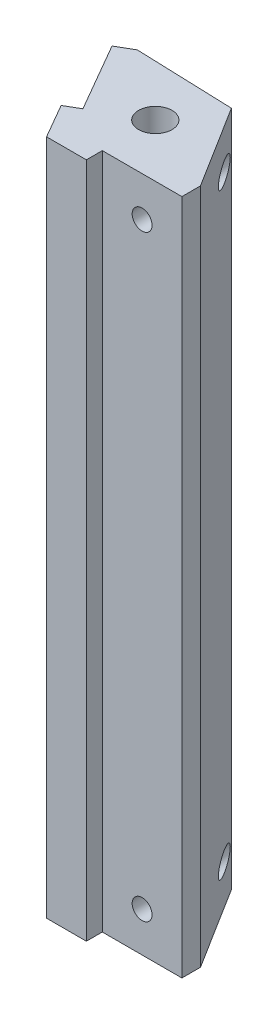
from build123d import *

# Parameters (mm, degrees)
BOSS_EXTRUDE1_DEPTH       = 85
SKETCH3_W                 = 10
SKETCH3_H                 = 2
CUT_EXTRUDE1_DEPTH        = 88.633826232
M5X0_8_TAPPED_HOLE1_D     = 4.2
M5X0_8_TAPPED_HOLE1_DEPTH = 16
M5X0_8_TAPPED_HOLE1_TIP   = 1.2618073
M5X0_8_TAPPED_HOLE2_D     = 4.2
M5X0_8_TAPPED_HOLE2_DEPTH = 16.4
M5X0_8_TAPPED_HOLE2_TIP   = 1.2618073
M3X0_5_TAPPED_HOLE1_D     = 2.5
M3X0_5_TAPPED_HOLE2_D     = 2.5


with BuildPart() as part:
    # Sketch1 → Boss-Extrude1 (new body)
    with BuildSketch(Plane(origin=(0, 0, 0), x_dir=(1, 0, 0), z_dir=(0, 1, 0))):
        Polygon((0, 0), (15, 0), (15, 4.330127019), (8.5, 14.722431864), (-3.75, 15.155444566), (-7.5, 12.990381057), align=None)
    extrude(amount=BOSS_EXTRUDE1_DEPTH)

    # Sketch3 → Cut-Extrude1 (cut, through all)
    with BuildSketch(Plane(origin=(0, 85, 0), x_dir=(1, 0, 0), z_dir=(0, 1, 0))):
        Polygon((-7.5, 12.990381057), (-5.767949192, 13.990381057), (-0.767949192, 5.330127019), (-2.5, 4.330127019), align=None)
        with Locations((10, 1)):
            Rectangle(SKETCH3_W, SKETCH3_H)
    extrude(amount=-CUT_EXTRUDE1_DEPTH, mode=Mode.SUBTRACT)

    # M5x0.8 Tapped Hole1
    with Locations(Plane(origin=(0, 85, 0), x_dir=(1, 0, 0), z_dir=(0, 1, 0))):
        with Locations((5, 8.660254038)):
            Hole(M5X0_8_TAPPED_HOLE1_D / 2, depth=M5X0_8_TAPPED_HOLE1_DEPTH)
            with Locations((0, 0, -(M5X0_8_TAPPED_HOLE1_DEPTH + M5X0_8_TAPPED_HOLE1_TIP / 2))):  # 118° drill point
                Cone(0, M5X0_8_TAPPED_HOLE1_D / 2, M5X0_8_TAPPED_HOLE1_TIP, mode=Mode.SUBTRACT)

    # M5x0.8 Tapped Hole2
    with Locations(Plane(origin=(0, 0, 0), x_dir=(-1, 0, 0), z_dir=(0, -1, 0))):
        with Locations((-5, 8.660254038)):
            Hole(M5X0_8_TAPPED_HOLE2_D / 2, depth=M5X0_8_TAPPED_HOLE2_DEPTH)
            with Locations((0, 0, -(M5X0_8_TAPPED_HOLE2_DEPTH + M5X0_8_TAPPED_HOLE2_TIP / 2))):  # 118° drill point
                Cone(0, M5X0_8_TAPPED_HOLE2_D / 2, M5X0_8_TAPPED_HOLE2_TIP, mode=Mode.SUBTRACT)

    # M3x0.5 Tapped Hole1 (through all)
    with Locations(Plane(origin=(1.732050808, 0, -1), x_dir=(0.49999999999999983, 0, 0.8660254037844387), z_dir=(-0.8660254037844387, 0, 0.49999999999999983))):
        with Locations((-10, 80), (-10, 5)):
            Hole(M3X0_5_TAPPED_HOLE1_D / 2)

    # M3x0.5 Tapped Hole2 (through all)
    with Locations(Plane.XY.offset(-2)):
        with Locations((10, 80), (10, 5)):
            Hole(M3X0_5_TAPPED_HOLE2_D / 2)


solid = part.part
